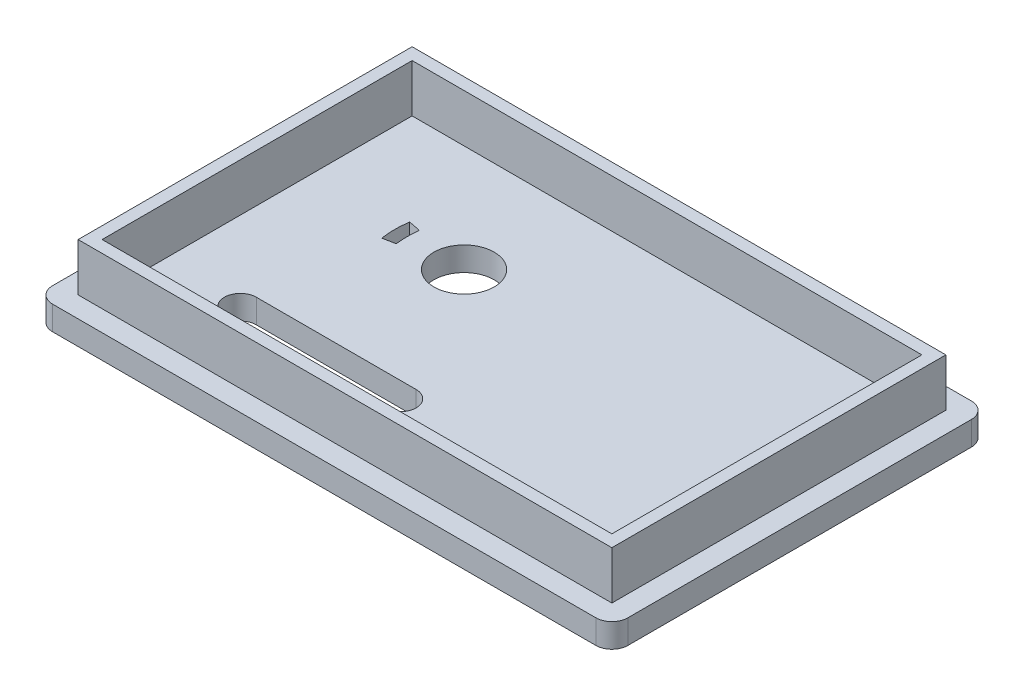
from build123d import *

# Parameters (mm, degrees)
SKETCH2_W           = 72
SKETCH2_H           = 47
BOSS_EXTRUDE1_DEPTH = 3
FILLET1_R           = 2
SKETCH3_W           = 66.8
SKETCH3_H           = 41.8
SKETCH3_W_2         = 63.8
SKETCH3_H_2         = 38.8
BOSS_EXTRUDE2_DEPTH = 6
CUT_EXTRUDE1_DEPTH  = 6
SKETCH5_R           = 3.775
CUT_EXTRUDE2_DEPTH  = 10
CUT_EXTRUDE3_DEPTH  = 10


with BuildPart() as part:
    # Sketch2 → Boss-Extrude1 (new body)
    with BuildSketch(Plane(origin=(0, 0, 0), x_dir=(1, 0, 0), z_dir=(0, 1, 0))):
        with Locations((36, 23.5)):
            Rectangle(SKETCH2_W, SKETCH2_H)
    extrude(amount=BOSS_EXTRUDE1_DEPTH)

    # Fillet1
    fillet1_edges = [part.edges().sort_by_distance(p)[0] for p in [
        (0, 1.5, 0),
        (72, 1.5, 0),
        (72, 1.5, -47),
        (0, 1.5, -47),
    ]]
    fillet(fillet1_edges, radius=FILLET1_R)

    # Sketch3 → Boss-Extrude2 (add)
    with BuildSketch(Plane(origin=(0, 3, 0), x_dir=(1, 0, 0), z_dir=(0, 1, 0))):
        with Locations((36, 23.5)):
            Rectangle(SKETCH3_W, SKETCH3_H)
        with Locations((36, 23.5)):
            Rectangle(SKETCH3_W_2, SKETCH3_H_2, mode=Mode.SUBTRACT)
    extrude(amount=BOSS_EXTRUDE2_DEPTH)

    # Sketch4 → Cut-Extrude1 (cut)
    with BuildSketch(Plane.XZ):
        with BuildLine():
            Line((14, -9.5), (34, -9.5))
            ThreePointArc((34, -9.5), (36, -11.5), (34, -13.5))
            Line((34, -13.5), (14, -13.5))
            ThreePointArc((14, -13.5), (12, -11.5), (14, -9.5))
        make_face()
    extrude(amount=-CUT_EXTRUDE1_DEPTH, mode=Mode.SUBTRACT)

    # Sketch5 → Cut-Extrude2 (cut)
    with BuildSketch(Plane.XZ):
        with Locations(Location((24, -29.5, 0), (0, 0, 270))):
            Circle(SKETCH5_R)
    extrude(amount=-CUT_EXTRUDE2_DEPTH, mode=Mode.SUBTRACT)

    # Sketch7 → Cut-Extrude3 (cut)
    with BuildSketch(Plane.XZ):
        with BuildLine():
            Line((16.95, -28.05), (15.45, -27.75))
            add(Edge.make_bspline(
                [(15.45, -27.75), (15.16612192, -29.525922028), (15.45, -31.25)],
                knots=[0, 0, 0, 0.895638879, 0.895638879, 0.895638879], degree=2))
            Line((15.45, -31.25), (16.95, -30.95))
            add(Edge.make_bspline(
                [(16.95, -28.05), (16.795171073, -29.515331085), (16.95, -30.95)],
                knots=[0, 0, 0, 0.544466013, 0.544466013, 0.544466013], degree=2))
        make_face()
    extrude(amount=-CUT_EXTRUDE3_DEPTH, mode=Mode.SUBTRACT)


solid = part.part
